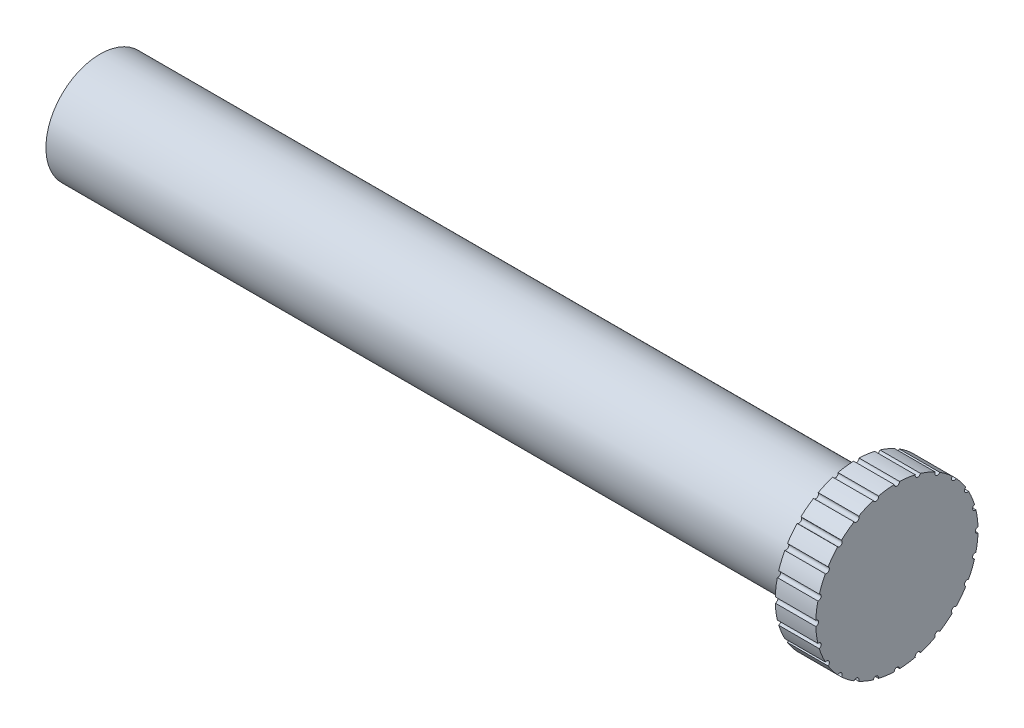
from build123d import *

# Parameters (mm, degrees)
SKETCH1_R           = 4
BOSS_EXTRUDE1_DEPTH = 55.94
SKETCH2_R           = 6
BOSS_EXTRUDE2_DEPTH = 3
CUT_EXTRUDE1_REACH  = 61.548
SKETCH3_R           = 0.2
CIRPATTERN1_COUNT   = 24


with BuildPart() as part:
    # Sketch1 → Boss-Extrude1 (new body)
    with BuildSketch(Plane(origin=(0, 0, 0), x_dir=(0, 0, -1), z_dir=(1, 0, 0))):
        Circle(SKETCH1_R)
    extrude(amount=BOSS_EXTRUDE1_DEPTH)

    # Sketch2 → Boss-Extrude2 (add)
    with BuildSketch(Plane(origin=(55.94, 0, 0), x_dir=(0, 0, -1), z_dir=(1, 0, 0))):
        Circle(SKETCH2_R)
    extrude(amount=BOSS_EXTRUDE2_DEPTH)

    # Sketch3 → Cut-Extrude1 (cut, up to next)
    with BuildSketch(Plane(origin=(58.94, 0, 0), x_dir=(0, 0, -1), z_dir=(1, 0, 0)), mode=Mode.PRIVATE) as cut_extrude1_sk1:
        with Locations((-6, 0)):
            Circle(SKETCH3_R)
    cut_extrude1_tool1 = extrude(cut_extrude1_sk1.sketch, amount=-CUT_EXTRUDE1_REACH, mode=Mode.PRIVATE) & part.part
    cut_extrude1 = cut_extrude1_tool1.solids().sort_by_distance((58.94, 0, 6))[0]
    add(cut_extrude1, mode=Mode.SUBTRACT)

    # CirPattern1: Cut-Extrude1 ×24 about axis
    cirpattern1_axis = Axis((0, 0, 0), (1, 0, 0))
    for i in range(1, CIRPATTERN1_COUNT):
        add(cut_extrude1.rotate(cirpattern1_axis, i * 360 / CIRPATTERN1_COUNT), mode=Mode.SUBTRACT)


solid = part.part
